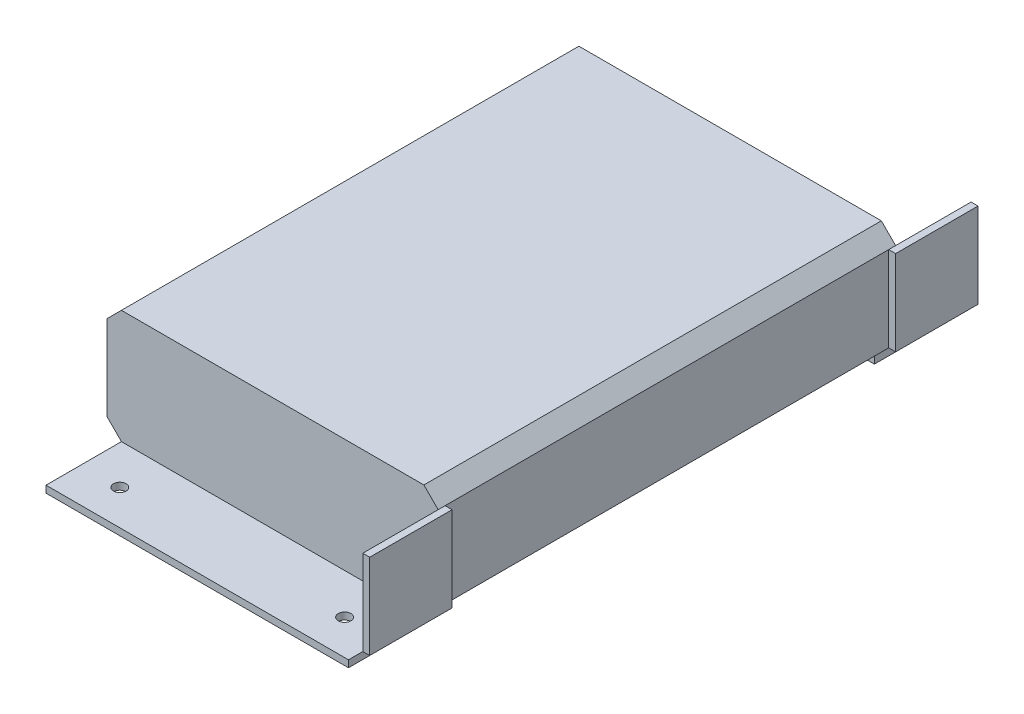
from build123d import *

# Parameters (mm, degrees)
SKETCH1_W                = 83.4
SKETCH1_H                = 28.65
BOSS_EXTRUDE1_DEPTH      = 115.25
CHAMFER1_SIZE            = 3.6
BOSS_EXTRUDE2_DEPTH      = 19
BOSS_EXTRUDE2_DEPTH_BACK = 1.75
SKETCH2_W                = 1.75
SKETCH2_H                = 21.45
SKETCH2_W_2              = 76.2
SKETCH2_H_2              = 1.75
BOSS_EXTRUDE4_DEPTH      = 1.75
BOSS_EXTRUDE4_DEPTH_BACK = 19
BOSS_EXTRUDE4_START      = -115.25
SKETCH2_2_W              = 1.75
SKETCH2_2_H              = 21.45
SKETCH2_2_W_2            = 76.2
SKETCH2_2_H_2            = 1.75
SKETCH3_R                = 1.6
CUT_EXTRUDE1_DEPTH       = 144.985372521


with BuildPart() as part:
    # Sketch1 → Boss-Extrude1 (new body)
    with BuildSketch(Plane.XY):
        Rectangle(SKETCH1_W, SKETCH1_H)
    extrude(amount=BOSS_EXTRUDE1_DEPTH)

    # Chamfer1
    chamfer1_edges = [part.edges().sort_by_distance(p)[0] for p in [
        (-41.7, -14.325, 57.625),
        (41.7, -14.325, 57.625),
        (41.7, 14.325, 57.625),
        (-41.7, 14.325, 57.625),
    ]]
    chamfer(chamfer1_edges, length=CHAMFER1_SIZE)

    # Sketch2 → Boss-Extrude2 (add, two sides: drawn at the far end of the back side and taken through both)
    with BuildSketch(Plane.XY.offset(115.25).offset(-BOSS_EXTRUDE2_DEPTH_BACK)):
        with Locations((42.575, 0)):
            Rectangle(SKETCH2_W, SKETCH2_H)
        with Locations((0, -15.2)):
            Rectangle(SKETCH2_W_2, SKETCH2_H_2)
    extrude(amount=BOSS_EXTRUDE2_DEPTH + BOSS_EXTRUDE2_DEPTH_BACK)

    # Sketch2<2> → Boss-Extrude4 (add, two sides: drawn at the far end of the back side and taken through both)
    with BuildSketch(Plane.XY.offset(115.25).offset(BOSS_EXTRUDE4_START - BOSS_EXTRUDE4_DEPTH_BACK)):
        with Locations((42.575, 0)):
            Rectangle(SKETCH2_2_W, SKETCH2_2_H)
        with Locations((0, -15.2)):
            Rectangle(SKETCH2_2_W_2, SKETCH2_2_H_2)
    extrude(amount=BOSS_EXTRUDE4_DEPTH + BOSS_EXTRUDE4_DEPTH_BACK)

    # Sketch3 → Cut-Extrude1 (cut, through all)
    with BuildSketch(Plane(origin=(0, -14.325, 0), x_dir=(1, 0, 0), z_dir=(0, 1, 0))):
        with Locations((-28.321, 10.193)):
            Circle(SKETCH3_R)
        with Locations((28.321, 10.193)):
            Circle(SKETCH3_R)
        with Locations((28.321, -125.443)):
            Circle(SKETCH3_R)
        with Locations((-28.321, -125.443)):
            Circle(SKETCH3_R)
    extrude(amount=-CUT_EXTRUDE1_DEPTH, mode=Mode.SUBTRACT)


solid = part.part
